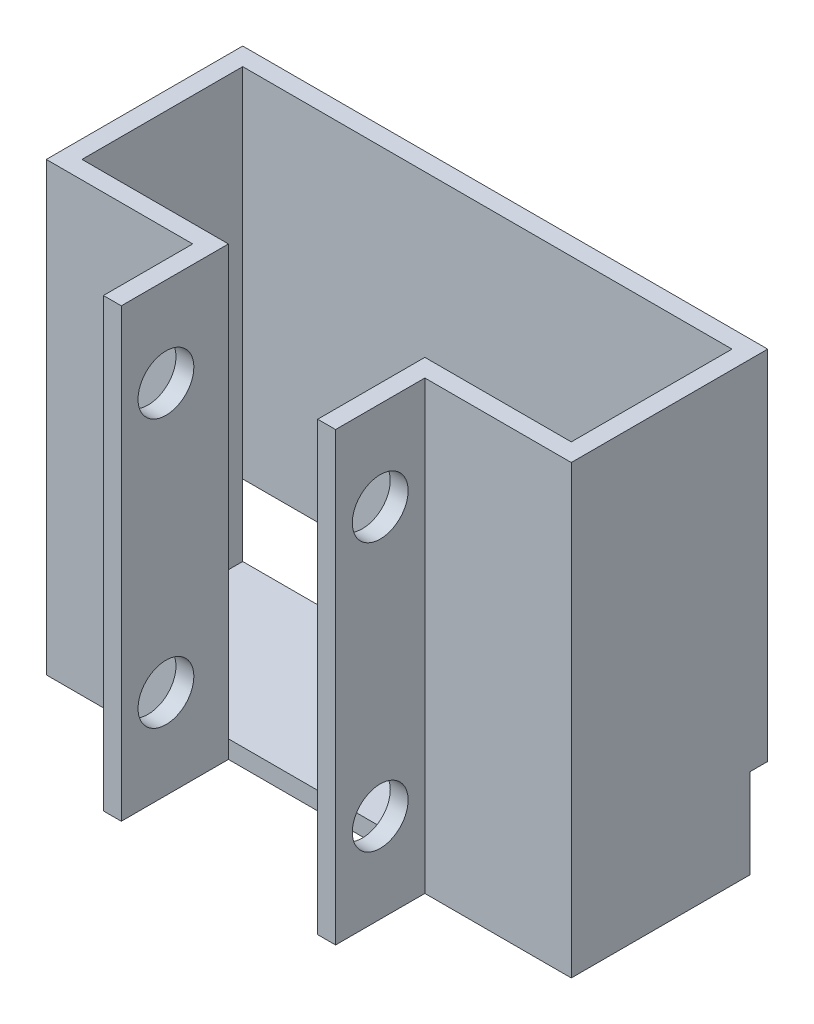
from build123d import *

# Parameters (mm, degrees)
SKETCH1_W           = 74.676
SKETCH1_H           = 63.5
BOSS_EXTRUDE1_DEPTH = 27.94
SKETCH2_W           = 69.596
SKETCH2_H           = 22.86
CUT_EXTRUDE1_DEPTH  = 60.96
SKETCH3_W           = 27.94
SKETCH3_H           = 63.5
CUT_EXTRUDE2_DEPTH  = 2.54
SKETCH4_W           = 74.676
SKETCH4_H           = 12.7
CUT_EXTRUDE3_DEPTH  = 2.54
SKETCH5_W           = 2.54
SKETCH5_H           = 63.5
BOSS_EXTRUDE2_DEPTH = 12.7
SKETCH6_R           = 3.96875
CUT_EXTRUDE4_DEPTH  = 50.8


with BuildPart() as part:
    # Sketch1 → Boss-Extrude1 (new body)
    with BuildSketch(Plane.XY):
        with Locations((1.344432395, -1.20243972)):
            Rectangle(SKETCH1_W, SKETCH1_H)
    extrude(amount=BOSS_EXTRUDE1_DEPTH)

    # Sketch2 → Cut-Extrude1 (cut)
    with BuildSketch(Plane(origin=(0, 30.54756028, 0), x_dir=(1, 0, 0), z_dir=(0, 1, 0))):
        with Locations((1.344432395, -13.97)):
            Rectangle(SKETCH2_W, SKETCH2_H)
    extrude(amount=-CUT_EXTRUDE1_DEPTH, mode=Mode.SUBTRACT)

    # Sketch3 → Cut-Extrude2 (cut)
    with BuildSketch(Plane.XY.offset(27.94)):
        with Locations((1.344432395, -1.20243972)):
            Rectangle(SKETCH3_W, SKETCH3_H)
    extrude(amount=-CUT_EXTRUDE2_DEPTH, mode=Mode.SUBTRACT)

    # Sketch4 → Cut-Extrude3 (cut)
    with BuildSketch(Plane(origin=(0, 0, 0), x_dir=(-1, 0, 0), z_dir=(0, 0, -1))):
        with Locations((-1.344432395, -26.60243972)):
            Rectangle(SKETCH4_W, SKETCH4_H)
    extrude(amount=-CUT_EXTRUDE3_DEPTH, mode=Mode.SUBTRACT)

    # Sketch5 → Boss-Extrude2 (add)
    with BuildSketch(Plane.XY.offset(27.94)):
        with Locations((-13.895567605, -1.20243972)):
            Rectangle(SKETCH5_W, SKETCH5_H)
        with Locations((16.584432395, -1.20243972)):
            Rectangle(SKETCH5_W, SKETCH5_H)
    extrude(amount=BOSS_EXTRUDE2_DEPTH)

    # Sketch6 → Cut-Extrude4 (cut)
    with BuildSketch(Plane.ZY.offset(15.165567605)):
        with Locations(Location((34.29, 17.84756028, 0), (0, 0, 270))):
            Circle(SKETCH6_R)
        with Locations(Location((34.29, -20.25243972, 0), (0, 0, 270))):
            Circle(SKETCH6_R)
    extrude(amount=-CUT_EXTRUDE4_DEPTH, mode=Mode.SUBTRACT)


solid = part.part
